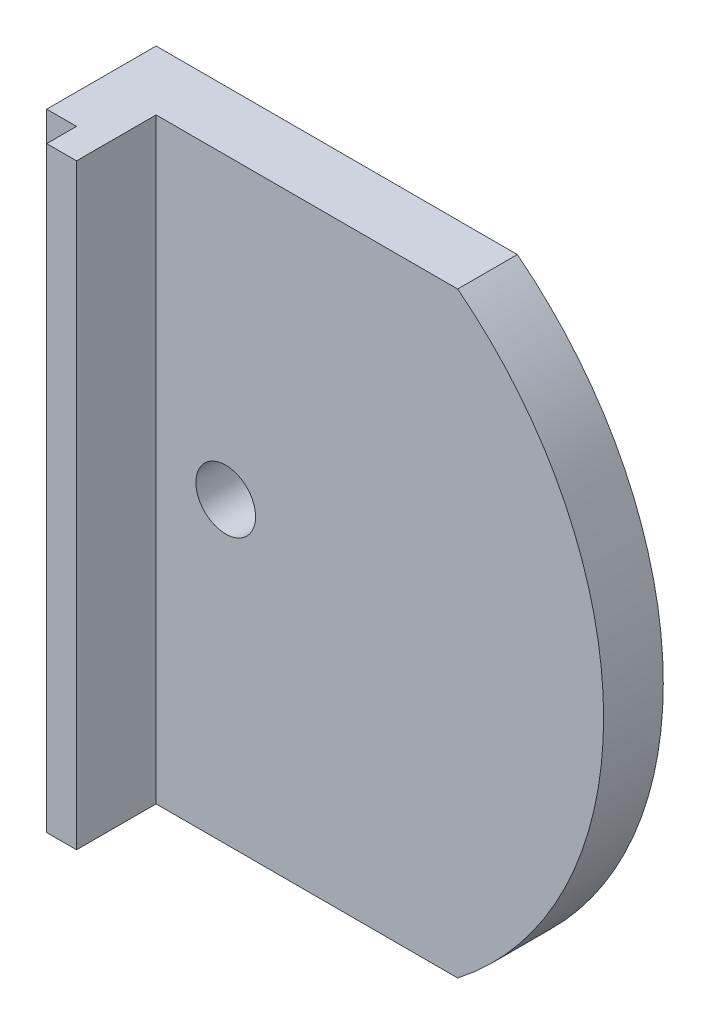
from build123d import *

# Parameters (mm, degrees)
EXTRU_MINCE1_DEPTH      = 15
ESQUISSE2_R             = 1.5
ENL_V_MAT_EXTRU_1_DEPTH = 32.144823005
ESQUISSE3_W             = 1.5
ESQUISSE3_H             = 1.5
ENL_V_MAT_EXTRU_2_DEPTH = 40.990623901
ESQUISSE4_R             = 6
ESQUISSE4_R_2           = 1.5
BOSS_EXTRU_1_DEPTH      = 2


with BuildPart() as part:
    # Esquisse1 → Extru.-Mince1 (new, symmetric)
    with BuildSketch(Plane(origin=(0, 0, 0), x_dir=(1, 0, 0), z_dir=(0, 1, 0))):
        Polygon((0, -7), (0, 0), (27, 0), (27, -3), (3, -3), (3, -7), align=None)
    extrude(amount=EXTRU_MINCE1_DEPTH, both=True)

    # Esquisse2 → Enlèv. mat.-Extru.1 (cut, through all)
    with BuildSketch(Plane.XY.offset(3)):
        with Locations((6.5, 0)):
            Circle(ESQUISSE2_R)
        with BuildLine():
            Line((18.16190379, -15), (27, -15))
            Line((27, -15), (27, 15))
            Line((27, 15), (18.16190379, 15))
            ThreePointArc((18.16190379, 15), (25.5, 0), (18.16190379, -15))
        make_face()
    extrude(amount=-ENL_V_MAT_EXTRU_1_DEPTH, mode=Mode.SUBTRACT)

    # Esquisse3 → Enlèv. mat.-Extru.2 (cut, through all)
    with BuildSketch(Plane(origin=(0, 15, 0), x_dir=(1, 0, 0), z_dir=(0, 1, 0))):
        with Locations((0.75, -6.25)):
            Rectangle(ESQUISSE3_W, ESQUISSE3_H)
    extrude(amount=-ENL_V_MAT_EXTRU_2_DEPTH, mode=Mode.SUBTRACT)

    # Esquisse4 → Boss.-Extru.1 (add)
    with BuildSketch(Plane(origin=(0, 0, 0), x_dir=(-1, 0, 0), z_dir=(0, 0, -1))):
        with Locations((-6.5, 0)):
            Circle(ESQUISSE4_R)
        with Locations(Location((-6.5, 0, 0), (0, 0, 180))):
            Circle(ESQUISSE4_R_2, mode=Mode.SUBTRACT)
    extrude(amount=BOSS_EXTRU_1_DEPTH)


solid = part.part
